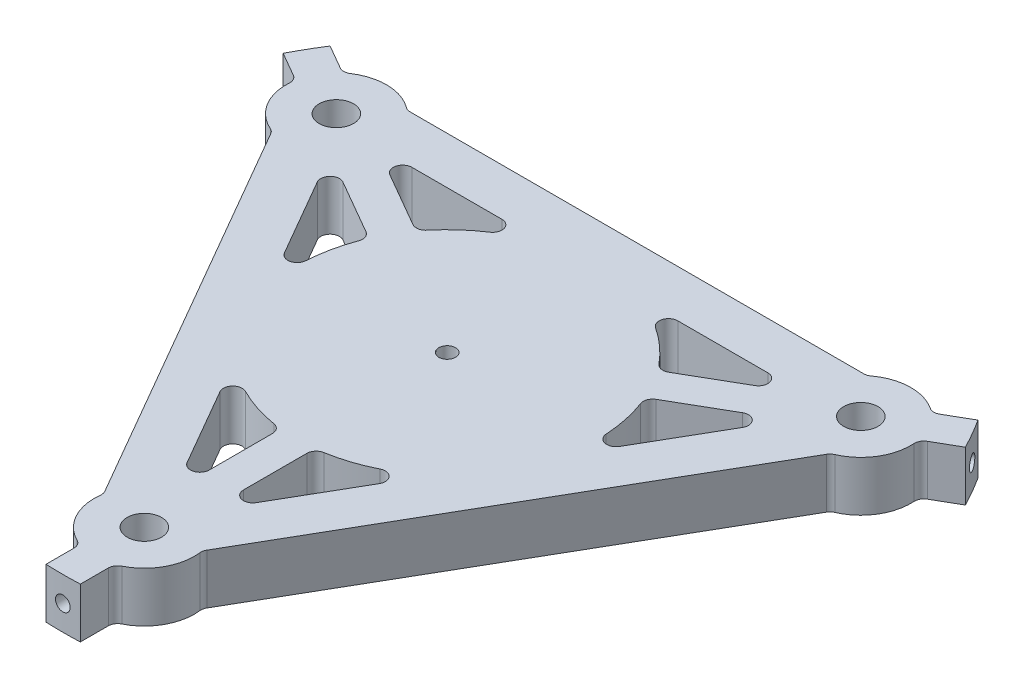
from build123d import *

# Parameters (mm, degrees)
SKETCH1_R           = 3.2639
SKETCH1_R_2         = 1.5875
BOSS_EXTRUDE1_DEPTH = 4.7625
SKETCH3_R           = 1.397
CUT_EXTRUDE1_DEPTH  = 6.35
CIRPATTERN1_COUNT   = 3


with BuildPart() as part:
    # Sketch1 → Boss-Extrude1 (new, symmetric)
    with BuildSketch(Plane(origin=(0, 0, 0), x_dir=(1, 0, 0), z_dir=(0, 1, 0))):
        with BuildLine():
            Line((-3.2639, -67.647177805), (-3.2639, -72.952022465))
            ThreePointArc((-3.2639, -72.952022465), (0, -73.025), (3.2639, -72.952022465))
            Line((3.2639, -72.952022465), (3.2639, -67.647177805))
            ThreePointArc((3.2639, -67.647177805), (3.530041907, -66.711459307), (4.248792135, -66.055868937))
            ThreePointArc((4.248792135, -66.055868937), (8.372836069, -62.072061677), (9.46261108, -56.442599084))
            ThreePointArc((9.46261108, -56.442599084), (9.488028557, -55.87828858), (9.68917198, -55.350430914))
            Line((9.68917198, -55.350430914), (52.779465272, 19.28414638))
            ThreePointArc((52.779465272, 19.28414638), (53.136031709, 19.722270528), (53.612030203, 20.026437961))
            ThreePointArc((53.612030203, 20.026437961), (57.942400312, 23.784942101), (59.330456636, 29.348372544))
            ThreePointArc((59.330456636, 29.348372544), (59.538839437, 30.298623685), (60.216124474, 30.996968587))
            Line((60.216124474, 30.996968587), (64.810254712, 33.649390917))
            ThreePointArc((64.810254712, 33.649390917), (63.241505111, 36.5125), (61.546354712, 39.302631548))
            Line((61.546354712, 39.302631548), (56.952224474, 36.650209218))
            ThreePointArc((56.952224474, 36.650209218), (56.00879753, 36.412835622), (55.081664501, 36.707496393))
            ThreePointArc((55.081664501, 36.707496393), (49.569564243, 38.287119576), (44.149419123, 36.416161123))
            ThreePointArc((44.149419123, 36.416161123), (43.648003152, 36.156018052), (43.090293292, 36.066284533))
            Line((43.090293292, 36.066284533), (-43.090293292, 36.066284533))
            ThreePointArc((-43.090293292, 36.066284533), (-43.648003152, 36.156018052), (-44.149419123, 36.416161123))
            ThreePointArc((-44.149419123, 36.416161123), (-49.569564243, 38.287119576), (-55.081664501, 36.707496393))
            ThreePointArc((-55.081664501, 36.707496393), (-56.00879753, 36.412835622), (-56.952224474, 36.650209218))
            Line((-56.952224474, 36.650209218), (-61.546354712, 39.302631548))
            ThreePointArc((-61.546354712, 39.302631548), (-63.241505111, 36.5125), (-64.810254712, 33.649390917))
            Line((-64.810254712, 33.649390917), (-60.216124474, 30.996968587))
            ThreePointArc((-60.216124474, 30.996968587), (-59.538839437, 30.298623685), (-59.330456636, 29.348372544))
            ThreePointArc((-59.330456636, 29.348372544), (-57.942400312, 23.784942101), (-53.612030203, 20.026437961))
            ThreePointArc((-53.612030203, 20.026437961), (-53.136031709, 19.722270528), (-52.779465272, 19.28414638))
            Line((-52.779465272, 19.28414638), (-9.68917198, -55.350430914))
            ThreePointArc((-9.68917198, -55.350430914), (-9.488028557, -55.87828858), (-9.46261108, -56.442599084))
            ThreePointArc((-9.46261108, -56.442599084), (-8.372836069, -62.072061677), (-4.248792135, -66.055868937))
            ThreePointArc((-4.248792135, -66.055868937), (-3.530041907, -66.711459307), (-3.2639, -67.647177805))
        make_face()
        with Locations(Location((0, -57.531, 0), (0, 0, 90))):
            Circle(SKETCH1_R, mode=Mode.SUBTRACT)
        with Locations(Location((-49.823307505, 28.7655, 0), (0, 0, 90))):
            Circle(SKETCH1_R, mode=Mode.SUBTRACT)
        with Locations(Location((49.823307505, 28.7655, 0), (0, 0, 90))):
            Circle(SKETCH1_R, mode=Mode.SUBTRACT)
        with Locations(Location((0, 0, 0), (0, 0, 90))):
            Circle(SKETCH1_R_2, mode=Mode.SUBTRACT)
        with BuildLine():
            Line((3.2639, -41.947085229), (3.2639, -29.931318938))
            ThreePointArc((3.2639, -29.931318938), (3.684254787, -28.783240772), (4.746558577, -28.178019921))
            ThreePointArc((4.746558577, -28.178019921), (8.86834191, -27.164004432), (12.794439011, -25.550595989))
            ThreePointArc((12.794439011, -25.550595989), (14.884524009, -25.921032832), (15.130330606, -28.029410851))
            Line((15.130330606, -28.029410851), (6.581693168, -42.836085229))
            ThreePointArc((6.581693168, -42.836085229), (4.581719738, -43.664501348), (3.2639, -41.947085229))
        make_face(mode=Mode.SUBTRACT)
        with BuildLine():
            Line((-3.2639, -41.947085229), (-3.2639, -29.931318938))
            ThreePointArc((-3.2639, -29.931318938), (-3.684254787, -28.783240772), (-4.746558577, -28.178019921))
            ThreePointArc((-4.746558577, -28.178019921), (-8.86834191, -27.164004432), (-12.794439011, -25.550595989))
            ThreePointArc((-12.794439011, -25.550595989), (-14.884524009, -25.921032832), (-15.130330606, -28.029410851))
            Line((-15.130330606, -28.029410851), (-6.581693168, -42.836085229))
            ThreePointArc((-6.581693168, -42.836085229), (-4.581719738, -43.664501348), (-3.2639, -41.947085229))
        make_face(mode=Mode.SUBTRACT)
        with BuildLine():
            Line((-34.695291423, 23.80016293), (-24.289332569, 17.792279785))
            ThreePointArc((-24.289332569, 17.792279785), (-23.084890319, 17.582278626), (-22.029601791, 18.199650269))
            ThreePointArc((-22.029601791, 18.199650269), (-19.090546952, 21.262211599), (-15.730245703, 23.855607205))
            ThreePointArc((-15.730245703, 23.855607205), (-15.00601092, 25.850892331), (-16.709016547, 27.117956098))
            Line((-16.709016547, 27.117956098), (-33.806291423, 27.117956098))
            ThreePointArc((-33.806291423, 27.117956098), (-35.523707542, 25.80013636), (-34.695291423, 23.80016293))
        make_face(mode=Mode.SUBTRACT)
        with BuildLine():
            Line((-37.959191423, 18.146922299), (-27.553232569, 12.139039154))
            ThreePointArc((-27.553232569, 12.139039154), (-26.769145106, 11.200962147), (-26.776160369, 9.978369652))
            ThreePointArc((-26.776160369, 9.978369652), (-27.958888861, 5.901792833), (-28.524684714, 1.694988784))
            ThreePointArc((-28.524684714, 1.694988784), (-29.890534929, 0.070140501), (-31.839347153, 0.911454753))
            Line((-31.839347153, 0.911454753), (-40.387984591, 15.718129131))
            ThreePointArc((-40.387984591, 15.718129131), (-40.10542728, 17.864364988), (-37.959191423, 18.146922299))
        make_face(mode=Mode.SUBTRACT)
        with BuildLine():
            Line((37.959191423, 18.146922299), (27.553232569, 12.139039154))
            ThreePointArc((27.553232569, 12.139039154), (26.769145106, 11.200962147), (26.776160369, 9.978369652))
            ThreePointArc((26.776160369, 9.978369652), (27.958888861, 5.901792833), (28.524684714, 1.694988784))
            ThreePointArc((28.524684714, 1.694988784), (29.890534929, 0.070140501), (31.839347153, 0.911454753))
            Line((31.839347153, 0.911454753), (40.387984591, 15.718129131))
            ThreePointArc((40.387984591, 15.718129131), (40.10542728, 17.864364988), (37.959191423, 18.146922299))
        make_face(mode=Mode.SUBTRACT)
        with BuildLine():
            Line((34.695291423, 23.80016293), (24.289332569, 17.792279785))
            ThreePointArc((24.289332569, 17.792279785), (23.084890319, 17.582278626), (22.029601791, 18.199650269))
            ThreePointArc((22.029601791, 18.199650269), (19.090546952, 21.262211599), (15.730245703, 23.855607205))
            ThreePointArc((15.730245703, 23.855607205), (15.00601092, 25.850892331), (16.709016547, 27.117956098))
            Line((16.709016547, 27.117956098), (33.806291423, 27.117956098))
            ThreePointArc((33.806291423, 27.117956098), (35.523707542, 25.80013636), (34.695291423, 23.80016293))
        make_face(mode=Mode.SUBTRACT)
    extrude(amount=BOSS_EXTRUDE1_DEPTH, both=True)

    # Sketch3 → Cut-Extrude1 (cut)
    with BuildSketch(Plane.XY.offset(73.025)):
        Circle(SKETCH3_R)
    cut_extrude1 = extrude(amount=-CUT_EXTRUDE1_DEPTH, mode=Mode.SUBTRACT)

    # CirPattern1: Cut-Extrude1 ×3 about axis
    cirpattern1_axis = Axis((0, 0, 0), (0, 1, 0))
    for i in range(1, CIRPATTERN1_COUNT):
        add(cut_extrude1.rotate(cirpattern1_axis, i * 360 / CIRPATTERN1_COUNT), mode=Mode.SUBTRACT)


solid = part.part
